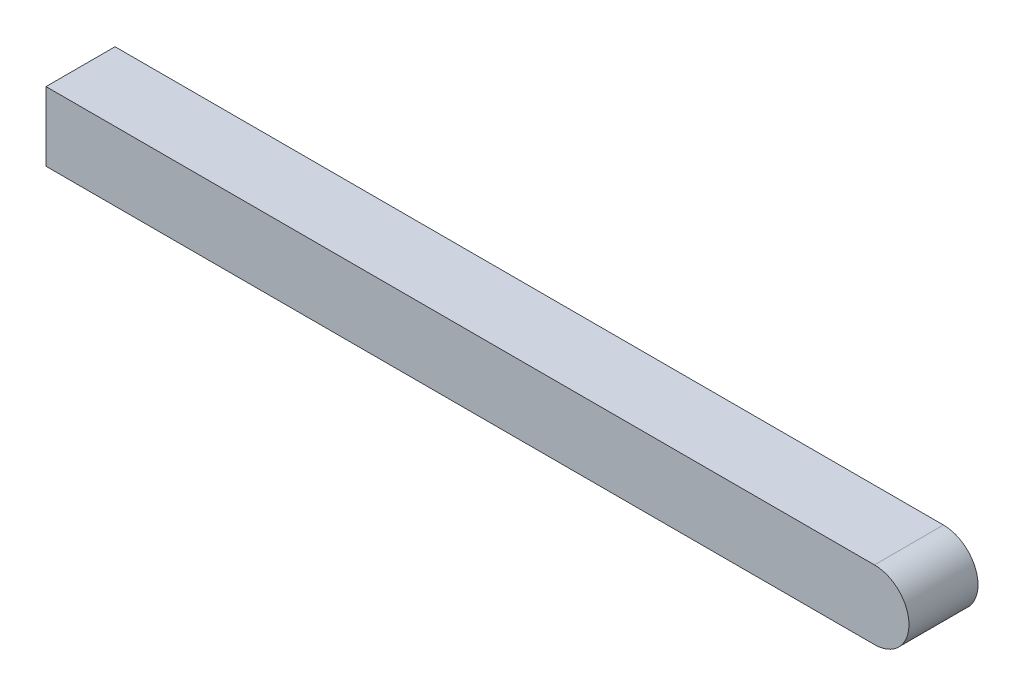
from build123d import *

# Parameters (mm, degrees)
EXTRUDE_1_DEPTH = 1


with BuildPart() as part:
    # 草图1 → 凸台-拉伸1 (new body)
    with BuildSketch(Plane.XY):
        with BuildLine():
            Line((-11.107291874, -0.48372324), (0.892708126, -0.48372324))
            ThreePointArc((0.892708126, -0.48372324), (1.392708126, 0.01627676), (0.892708126, 0.51627676))
            Line((0.892708126, 0.51627676), (-11.107291874, 0.51627676))
            Line((-11.107291874, 0.51627676), (-11.107291874, -0.48372324))
        make_face()
    extrude(amount=EXTRUDE_1_DEPTH)


solid = part.part
